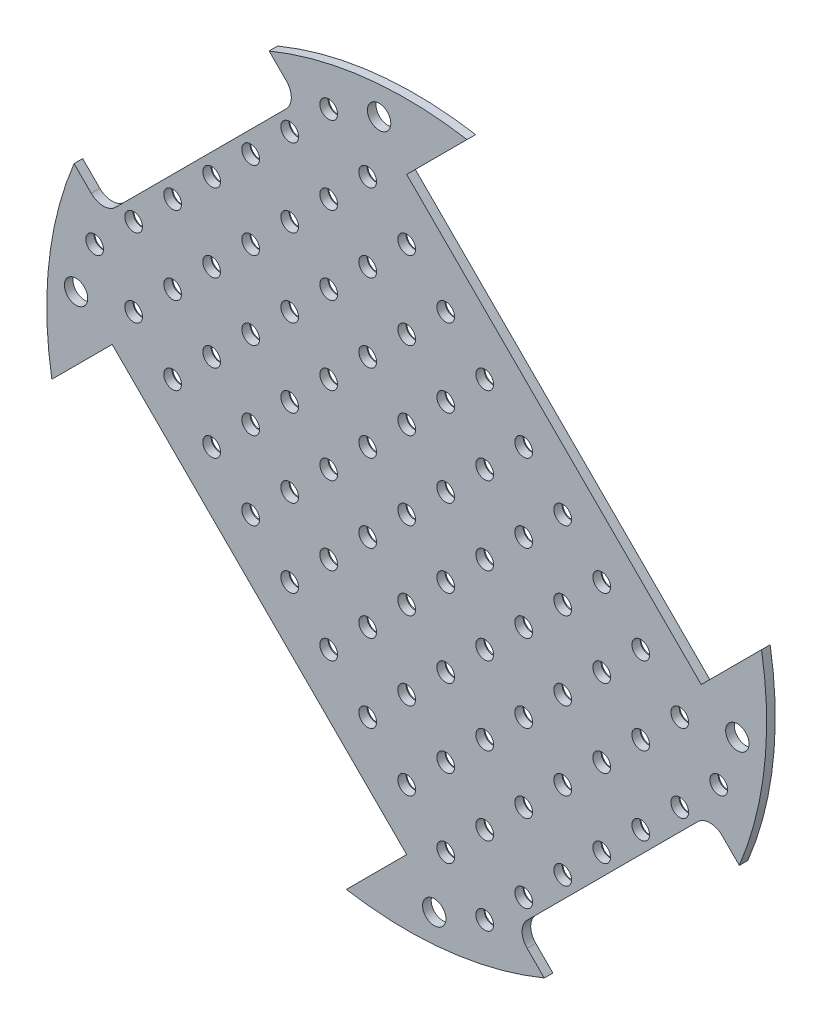
from build123d import *

# Parameters (mm, degrees)
SKETCH1_R             = 66.294
EXTRUDE1_DEPTH        = 1.5875
EXTRUDE2_DEPTH        = 94.767313219
CIRPATTERN1_COUNT     = 2
CIRPATTERN1_ANGLE     = 180
EXTRUDE3_DEPTH        = 94.767313219
CIRPATTERN4_COUNT     = 2
CIRPATTERN4_ANGLE     = 180
F_6_CLEARANCE_HOLE1_D = 4.3053
CIRPATTERN3_COUNT     = 2
CIRPATTERN3_ANGLE     = 180
LPATTERN1_COUNT       = 4
LPATTERN1_PITCH       = 10.16
LPATTERN1_COL_COUNT   = 4
LPATTERN1_COL_PITCH   = 10.16
LPATTERN2_COUNT       = 6
LPATTERN2_PITCH       = 10.16
LPATTERN2_COL_COUNT   = 6
LPATTERN2_COL_PITCH   = 10.16
FILLET1_R             = 3.175


with BuildPart() as part:
    # Sketch1 → Extrude1 (new body)
    with BuildSketch(Plane.XY):
        Circle(SKETCH1_R)
    extrude(amount=EXTRUDE1_DEPTH)

    # Sketch3 → Extrude2 (cut, through all)
    with BuildSketch(Plane.XY.offset(1.5875)):
        Polygon((0, 54.240746971), (54.240746971, 0), (66.421, 12.180253029), (66.421, 66.421), (12.180253029, 66.421), align=None)
    extrude2 = extrude(amount=-EXTRUDE2_DEPTH, mode=Mode.SUBTRACT)

    # CirPattern1: Extrude2 ×2 about axis
    cirpattern1_axis = Axis((0, 0, 0), (0, 0, 1))
    for i in range(1, CIRPATTERN1_COUNT):
        add(extrude2.rotate(cirpattern1_axis, i * CIRPATTERN1_ANGLE / (CIRPATTERN1_COUNT - 1)), mode=Mode.SUBTRACT)

    # Sketch11 → Extrude3 (cut, through all)
    with BuildSketch(Plane(origin=(0, 0, 0), x_dir=(-1, 0, 0), z_dir=(0, 0, -1))):
        Polygon((-55.860393937, -19.939369453), (-69.011215099, -33.090190614), (-33.090190614, -69.011215099), (-19.939369453, -55.860393937), align=None)
    extrude3 = extrude(amount=-EXTRUDE3_DEPTH, mode=Mode.SUBTRACT)

    # CirPattern4: Extrude3 ×2 about axis
    cirpattern4_axis = Axis((0, 0, 0), (0, 0, 1))
    for i in range(1, CIRPATTERN4_COUNT):
        add(extrude3.rotate(cirpattern4_axis, i * CIRPATTERN4_ANGLE / (CIRPATTERN4_COUNT - 1)), mode=Mode.SUBTRACT)

    # #6 Clearance Hole1 (through all)
    with Locations(Plane(origin=(-5.08, 60.8965, 1.5875), x_dir=(1, 0, 0), z_dir=(0, 0, 1))):
        with Locations((0, 0), (65.9765, -65.9765)):
            f_6_clearance_hole1 = Hole(F_6_CLEARANCE_HOLE1_D / 2)

    # CirPattern3: #6 Clearance Hole1 ×2 about axis
    cirpattern3_axis = Axis((0, 0, 0), (0, 0, 1))
    for i in range(1, CIRPATTERN3_COUNT):
        add(f_6_clearance_hole1.rotate(cirpattern3_axis, i * CIRPATTERN3_ANGLE / (CIRPATTERN3_COUNT - 1)), mode=Mode.SUBTRACT)

    # Sketch33 → #4 Clearance Hole4 (revolve, cut)
    with BuildSketch(Plane(origin=(0, 0, 1.5875), x_dir=(0, -1, 0), z_dir=(1, 0, 0))):
        Polygon((0, 0), (0, 2.504574487), (1.63195, 1.524), (1.63195, 0), align=None)
    f_4_clearance_hole4 = revolve(axis=Axis((0, 0, 7.9375), (0, 0, -1)), mode=Mode.SUBTRACT)

    # LPattern1: #4 Clearance Hole4 ×4
    with Locations(*[Vector(-0.7071067811865526, -0.7071067811865426, 0) * (i * LPATTERN1_PITCH) for i in range(1, LPATTERN1_COUNT)]):
        add(f_4_clearance_hole4, mode=Mode.SUBTRACT)

    # LPattern1 col: #4 Clearance Hole4 ×4
    with Locations(*[Vector(0.7071067811865476, 0.7071067811865475, 0) * (i * LPATTERN1_COL_PITCH) for i in range(1, LPATTERN1_COL_COUNT)]):
        add(f_4_clearance_hole4, mode=Mode.SUBTRACT)

    # LPattern2: #4 Clearance Hole4 ×6
    with Locations(*[Vector(0.7071067811865476, -0.7071067811865476, 0) * (i * LPATTERN2_PITCH) for i in range(1, LPATTERN2_COUNT)]):
        add(f_4_clearance_hole4, mode=Mode.SUBTRACT)

    # LPattern2 copy 1 sketch → LPattern2 copy 1 (revolve, cut)
    with BuildSketch(Plane(origin=(0, -14.368409794, 1.5875), x_dir=(0, -1, 0), z_dir=(1, 0, 0))):
        Polygon((0, 0), (0, 2.504574487), (1.63195, 1.524), (1.63195, 0), align=None)
    revolve(axis=Axis((0, -14.368409794, 7.9375), (0, 0, -1)), mode=Mode.SUBTRACT)

    # LPattern2 copy 2 sketch → LPattern2 copy 2 (revolve, cut)
    with BuildSketch(Plane(origin=(7.184204897, -21.552614691, 1.5875), x_dir=(0, -1, 0), z_dir=(1, 0, 0))):
        Polygon((0, 0), (0, 2.504574487), (1.63195, 1.524), (1.63195, 0), align=None)
    revolve(axis=Axis((7.184204897, -21.552614691, 7.9375), (0, 0, -1)), mode=Mode.SUBTRACT)

    # LPattern2 copy 3 sketch → LPattern2 copy 3 (revolve, cut)
    with BuildSketch(Plane(origin=(14.368409794, -28.736819587, 1.5875), x_dir=(0, -1, 0), z_dir=(1, 0, 0))):
        Polygon((0, 0), (0, 2.504574487), (1.63195, 1.524), (1.63195, 0), align=None)
    revolve(axis=Axis((14.368409794, -28.736819587, 7.9375), (0, 0, -1)), mode=Mode.SUBTRACT)

    # LPattern2 copy 4 sketch → LPattern2 copy 4 (revolve, cut)
    with BuildSketch(Plane(origin=(21.552614691, -35.921024484, 1.5875), x_dir=(0, -1, 0), z_dir=(1, 0, 0))):
        Polygon((0, 0), (0, 2.504574487), (1.63195, 1.524), (1.63195, 0), align=None)
    revolve(axis=Axis((21.552614691, -35.921024484, 7.9375), (0, 0, -1)), mode=Mode.SUBTRACT)

    # LPattern2 copy 5 sketch → LPattern2 copy 5 (revolve, cut)
    with BuildSketch(Plane(origin=(28.736819587, -43.105229381, 1.5875), x_dir=(0, -1, 0), z_dir=(1, 0, 0))):
        Polygon((0, 0), (0, 2.504574487), (1.63195, 1.524), (1.63195, 0), align=None)
    revolve(axis=Axis((28.736819587, -43.105229381, 7.9375), (0, 0, -1)), mode=Mode.SUBTRACT)

    # LPattern2 copy 6 sketch → LPattern2 copy 6 (revolve, cut)
    with BuildSketch(Plane(origin=(-7.184204897, -21.552614691, 1.5875), x_dir=(0, -1, 0), z_dir=(1, 0, 0))):
        Polygon((0, 0), (0, 2.504574487), (1.63195, 1.524), (1.63195, 0), align=None)
    revolve(axis=Axis((-7.184204897, -21.552614691, 7.9375), (0, 0, -1)), mode=Mode.SUBTRACT)

    # LPattern2 copy 7 sketch → LPattern2 copy 7 (revolve, cut)
    with BuildSketch(Plane(origin=(0, -28.736819587, 1.5875), x_dir=(0, -1, 0), z_dir=(1, 0, 0))):
        Polygon((0, 0), (0, 2.504574487), (1.63195, 1.524), (1.63195, 0), align=None)
    revolve(axis=Axis((0, -28.736819587, 7.9375), (0, 0, -1)), mode=Mode.SUBTRACT)

    # LPattern2 copy 8 sketch → LPattern2 copy 8 (revolve, cut)
    with BuildSketch(Plane(origin=(7.184204897, -35.921024484, 1.5875), x_dir=(0, -1, 0), z_dir=(1, 0, 0))):
        Polygon((0, 0), (0, 2.504574487), (1.63195, 1.524), (1.63195, 0), align=None)
    revolve(axis=Axis((7.184204897, -35.921024484, 7.9375), (0, 0, -1)), mode=Mode.SUBTRACT)

    # LPattern2 copy 9 sketch → LPattern2 copy 9 (revolve, cut)
    with BuildSketch(Plane(origin=(14.368409794, -43.105229381, 1.5875), x_dir=(0, -1, 0), z_dir=(1, 0, 0))):
        Polygon((0, 0), (0, 2.504574487), (1.63195, 1.524), (1.63195, 0), align=None)
    revolve(axis=Axis((14.368409794, -43.105229381, 7.9375), (0, 0, -1)), mode=Mode.SUBTRACT)

    # LPattern2 copy 10 sketch → LPattern2 copy 10 (revolve, cut)
    with BuildSketch(Plane(origin=(21.552614691, -50.289434278, 1.5875), x_dir=(0, -1, 0), z_dir=(1, 0, 0))):
        Polygon((0, 0), (0, 2.504574487), (1.63195, 1.524), (1.63195, 0), align=None)
    revolve(axis=Axis((21.552614691, -50.289434278, 7.9375), (0, 0, -1)), mode=Mode.SUBTRACT)

    # LPattern2 copy 11 sketch → LPattern2 copy 11 (revolve, cut)
    with BuildSketch(Plane(origin=(-14.368409794, -28.736819587, 1.5875), x_dir=(0, -1, 0), z_dir=(1, 0, 0))):
        Polygon((0, 0), (0, 2.504574487), (1.63195, 1.524), (1.63195, 0), align=None)
    revolve(axis=Axis((-14.368409794, -28.736819587, 7.9375), (0, 0, -1)), mode=Mode.SUBTRACT)

    # LPattern2 copy 12 sketch → LPattern2 copy 12 (revolve, cut)
    with BuildSketch(Plane(origin=(-7.184204897, -35.921024484, 1.5875), x_dir=(0, -1, 0), z_dir=(1, 0, 0))):
        Polygon((0, 0), (0, 2.504574487), (1.63195, 1.524), (1.63195, 0), align=None)
    revolve(axis=Axis((-7.184204897, -35.921024484, 7.9375), (0, 0, -1)), mode=Mode.SUBTRACT)

    # LPattern2 copy 13 sketch → LPattern2 copy 13 (revolve, cut)
    with BuildSketch(Plane(origin=(0, -43.105229381, 1.5875), x_dir=(0, -1, 0), z_dir=(1, 0, 0))):
        Polygon((0, 0), (0, 2.504574487), (1.63195, 1.524), (1.63195, 0), align=None)
    revolve(axis=Axis((0, -43.105229381, 7.9375), (0, 0, -1)), mode=Mode.SUBTRACT)

    # LPattern2 copy 14 sketch → LPattern2 copy 14 (revolve, cut)
    with BuildSketch(Plane(origin=(7.184204897, -50.289434278, 1.5875), x_dir=(0, -1, 0), z_dir=(1, 0, 0))):
        Polygon((0, 0), (0, 2.504574487), (1.63195, 1.524), (1.63195, 0), align=None)
    revolve(axis=Axis((7.184204897, -50.289434278, 7.9375), (0, 0, -1)), mode=Mode.SUBTRACT)

    # LPattern2 copy 15 sketch → LPattern2 copy 15 (revolve, cut)
    with BuildSketch(Plane(origin=(14.368409794, -57.473639175, 1.5875), x_dir=(0, -1, 0), z_dir=(1, 0, 0))):
        Polygon((0, 0), (0, 2.504574487), (1.63195, 1.524), (1.63195, 0), align=None)
    revolve(axis=Axis((14.368409794, -57.473639175, 7.9375), (0, 0, -1)), mode=Mode.SUBTRACT)

    # LPattern2 copy 16 sketch → LPattern2 copy 16 (revolve, cut)
    with BuildSketch(Plane(origin=(14.368409794, 0, 1.5875), x_dir=(0, -1, 0), z_dir=(1, 0, 0))):
        Polygon((0, 0), (0, 2.504574487), (1.63195, 1.524), (1.63195, 0), align=None)
    revolve(axis=Axis((14.368409794, 0, 7.9375), (0, 0, -1)), mode=Mode.SUBTRACT)

    # LPattern2 copy 17 sketch → LPattern2 copy 17 (revolve, cut)
    with BuildSketch(Plane(origin=(21.552614691, -7.184204897, 1.5875), x_dir=(0, -1, 0), z_dir=(1, 0, 0))):
        Polygon((0, 0), (0, 2.504574487), (1.63195, 1.524), (1.63195, 0), align=None)
    revolve(axis=Axis((21.552614691, -7.184204897, 7.9375), (0, 0, -1)), mode=Mode.SUBTRACT)

    # LPattern2 copy 18 sketch → LPattern2 copy 18 (revolve, cut)
    with BuildSketch(Plane(origin=(28.736819587, -14.368409794, 1.5875), x_dir=(0, -1, 0), z_dir=(1, 0, 0))):
        Polygon((0, 0), (0, 2.504574487), (1.63195, 1.524), (1.63195, 0), align=None)
    revolve(axis=Axis((28.736819587, -14.368409794, 7.9375), (0, 0, -1)), mode=Mode.SUBTRACT)

    # LPattern2 copy 19 sketch → LPattern2 copy 19 (revolve, cut)
    with BuildSketch(Plane(origin=(35.921024484, -21.552614691, 1.5875), x_dir=(0, -1, 0), z_dir=(1, 0, 0))):
        Polygon((0, 0), (0, 2.504574487), (1.63195, 1.524), (1.63195, 0), align=None)
    revolve(axis=Axis((35.921024484, -21.552614691, 7.9375), (0, 0, -1)), mode=Mode.SUBTRACT)

    # LPattern2 copy 20 sketch → LPattern2 copy 20 (revolve, cut)
    with BuildSketch(Plane(origin=(43.105229381, -28.736819587, 1.5875), x_dir=(0, -1, 0), z_dir=(1, 0, 0))):
        Polygon((0, 0), (0, 2.504574487), (1.63195, 1.524), (1.63195, 0), align=None)
    revolve(axis=Axis((43.105229381, -28.736819587, 7.9375), (0, 0, -1)), mode=Mode.SUBTRACT)

    # LPattern2 copy 21 sketch → LPattern2 copy 21 (revolve, cut)
    with BuildSketch(Plane(origin=(21.552614691, 7.184204897, 1.5875), x_dir=(0, -1, 0), z_dir=(1, 0, 0))):
        Polygon((0, 0), (0, 2.504574487), (1.63195, 1.524), (1.63195, 0), align=None)
    revolve(axis=Axis((21.552614691, 7.184204897, 7.9375), (0, 0, -1)), mode=Mode.SUBTRACT)

    # LPattern2 copy 22 sketch → LPattern2 copy 22 (revolve, cut)
    with BuildSketch(Plane(origin=(28.736819587, 0, 1.5875), x_dir=(0, -1, 0), z_dir=(1, 0, 0))):
        Polygon((0, 0), (0, 2.504574487), (1.63195, 1.524), (1.63195, 0), align=None)
    revolve(axis=Axis((28.736819587, 0, 7.9375), (0, 0, -1)), mode=Mode.SUBTRACT)

    # LPattern2 copy 23 sketch → LPattern2 copy 23 (revolve, cut)
    with BuildSketch(Plane(origin=(35.921024484, -7.184204897, 1.5875), x_dir=(0, -1, 0), z_dir=(1, 0, 0))):
        Polygon((0, 0), (0, 2.504574487), (1.63195, 1.524), (1.63195, 0), align=None)
    revolve(axis=Axis((35.921024484, -7.184204897, 7.9375), (0, 0, -1)), mode=Mode.SUBTRACT)

    # LPattern2 copy 24 sketch → LPattern2 copy 24 (revolve, cut)
    with BuildSketch(Plane(origin=(43.105229381, -14.368409794, 1.5875), x_dir=(0, -1, 0), z_dir=(1, 0, 0))):
        Polygon((0, 0), (0, 2.504574487), (1.63195, 1.524), (1.63195, 0), align=None)
    revolve(axis=Axis((43.105229381, -14.368409794, 7.9375), (0, 0, -1)), mode=Mode.SUBTRACT)

    # LPattern2 copy 25 sketch → LPattern2 copy 25 (revolve, cut)
    with BuildSketch(Plane(origin=(50.289434278, -21.552614691, 1.5875), x_dir=(0, -1, 0), z_dir=(1, 0, 0))):
        Polygon((0, 0), (0, 2.504574487), (1.63195, 1.524), (1.63195, 0), align=None)
    revolve(axis=Axis((50.289434278, -21.552614691, 7.9375), (0, 0, -1)), mode=Mode.SUBTRACT)

    # LPattern2 copy 26 sketch → LPattern2 copy 26 (revolve, cut)
    with BuildSketch(Plane(origin=(28.736819587, 14.368409794, 1.5875), x_dir=(0, -1, 0), z_dir=(1, 0, 0))):
        Polygon((0, 0), (0, 2.504574487), (1.63195, 1.524), (1.63195, 0), align=None)
    revolve(axis=Axis((28.736819587, 14.368409794, 7.9375), (0, 0, -1)), mode=Mode.SUBTRACT)

    # LPattern2 copy 27 sketch → LPattern2 copy 27 (revolve, cut)
    with BuildSketch(Plane(origin=(35.921024484, 7.184204897, 1.5875), x_dir=(0, -1, 0), z_dir=(1, 0, 0))):
        Polygon((0, 0), (0, 2.504574487), (1.63195, 1.524), (1.63195, 0), align=None)
    revolve(axis=Axis((35.921024484, 7.184204897, 7.9375), (0, 0, -1)), mode=Mode.SUBTRACT)

    # LPattern2 copy 28 sketch → LPattern2 copy 28 (revolve, cut)
    with BuildSketch(Plane(origin=(43.105229381, 0, 1.5875), x_dir=(0, -1, 0), z_dir=(1, 0, 0))):
        Polygon((0, 0), (0, 2.504574487), (1.63195, 1.524), (1.63195, 0), align=None)
    revolve(axis=Axis((43.105229381, 0, 7.9375), (0, 0, -1)), mode=Mode.SUBTRACT)

    # LPattern2 copy 29 sketch → LPattern2 copy 29 (revolve, cut)
    with BuildSketch(Plane(origin=(50.289434278, -7.184204897, 1.5875), x_dir=(0, -1, 0), z_dir=(1, 0, 0))):
        Polygon((0, 0), (0, 2.504574487), (1.63195, 1.524), (1.63195, 0), align=None)
    revolve(axis=Axis((50.289434278, -7.184204897, 7.9375), (0, 0, -1)), mode=Mode.SUBTRACT)

    # LPattern2 copy 30 sketch → LPattern2 copy 30 (revolve, cut)
    with BuildSketch(Plane(origin=(57.473639175, -14.368409794, 1.5875), x_dir=(0, -1, 0), z_dir=(1, 0, 0))):
        Polygon((0, 0), (0, 2.504574487), (1.63195, 1.524), (1.63195, 0), align=None)
    revolve(axis=Axis((57.473639175, -14.368409794, 7.9375), (0, 0, -1)), mode=Mode.SUBTRACT)

    # LPattern2 col: #4 Clearance Hole4 ×6
    with Locations(*[Vector(-0.7071067811865526, 0.7071067811865426, 0) * (i * LPATTERN2_COL_PITCH) for i in range(1, LPATTERN2_COL_COUNT)]):
        add(f_4_clearance_hole4, mode=Mode.SUBTRACT)

    # LPattern2 col copy 1 sketch → LPattern2 col copy 1 (revolve, cut)
    with BuildSketch(Plane(origin=(-14.368409794, 0, 1.5875), x_dir=(0, -1, 0), z_dir=(1, 0, 0))):
        Polygon((0, 0), (0, 2.504574487), (1.63195, 1.524), (1.63195, 0), align=None)
    revolve(axis=Axis((-14.368409794, 0, 7.9375), (0, 0, -1)), mode=Mode.SUBTRACT)

    # LPattern2 col copy 2 sketch → LPattern2 col copy 2 (revolve, cut)
    with BuildSketch(Plane(origin=(-21.552614691, 7.184204897, 1.5875), x_dir=(0, -1, 0), z_dir=(1, 0, 0))):
        Polygon((0, 0), (0, 2.504574487), (1.63195, 1.524), (1.63195, 0), align=None)
    revolve(axis=Axis((-21.552614691, 7.184204897, 7.9375), (0, 0, -1)), mode=Mode.SUBTRACT)

    # LPattern2 col copy 3 sketch → LPattern2 col copy 3 (revolve, cut)
    with BuildSketch(Plane(origin=(-28.736819587, 14.368409794, 1.5875), x_dir=(0, -1, 0), z_dir=(1, 0, 0))):
        Polygon((0, 0), (0, 2.504574487), (1.63195, 1.524), (1.63195, 0), align=None)
    revolve(axis=Axis((-28.736819587, 14.368409794, 7.9375), (0, 0, -1)), mode=Mode.SUBTRACT)

    # LPattern2 col copy 4 sketch → LPattern2 col copy 4 (revolve, cut)
    with BuildSketch(Plane(origin=(-35.921024484, 21.552614691, 1.5875), x_dir=(0, -1, 0), z_dir=(1, 0, 0))):
        Polygon((0, 0), (0, 2.504574487), (1.63195, 1.524), (1.63195, 0), align=None)
    revolve(axis=Axis((-35.921024484, 21.552614691, 7.9375), (0, 0, -1)), mode=Mode.SUBTRACT)

    # LPattern2 col copy 5 sketch → LPattern2 col copy 5 (revolve, cut)
    with BuildSketch(Plane(origin=(-43.105229381, 28.736819587, 1.5875), x_dir=(0, -1, 0), z_dir=(1, 0, 0))):
        Polygon((0, 0), (0, 2.504574487), (1.63195, 1.524), (1.63195, 0), align=None)
    revolve(axis=Axis((-43.105229381, 28.736819587, 7.9375), (0, 0, -1)), mode=Mode.SUBTRACT)

    # LPattern2 col copy 6 sketch → LPattern2 col copy 6 (revolve, cut)
    with BuildSketch(Plane(origin=(-21.552614691, -7.184204897, 1.5875), x_dir=(0, -1, 0), z_dir=(1, 0, 0))):
        Polygon((0, 0), (0, 2.504574487), (1.63195, 1.524), (1.63195, 0), align=None)
    revolve(axis=Axis((-21.552614691, -7.184204897, 7.9375), (0, 0, -1)), mode=Mode.SUBTRACT)

    # LPattern2 col copy 7 sketch → LPattern2 col copy 7 (revolve, cut)
    with BuildSketch(Plane(origin=(-28.736819587, 0, 1.5875), x_dir=(0, -1, 0), z_dir=(1, 0, 0))):
        Polygon((0, 0), (0, 2.504574487), (1.63195, 1.524), (1.63195, 0), align=None)
    revolve(axis=Axis((-28.736819587, 0, 7.9375), (0, 0, -1)), mode=Mode.SUBTRACT)

    # LPattern2 col copy 8 sketch → LPattern2 col copy 8 (revolve, cut)
    with BuildSketch(Plane(origin=(-35.921024484, 7.184204897, 1.5875), x_dir=(0, -1, 0), z_dir=(1, 0, 0))):
        Polygon((0, 0), (0, 2.504574487), (1.63195, 1.524), (1.63195, 0), align=None)
    revolve(axis=Axis((-35.921024484, 7.184204897, 7.9375), (0, 0, -1)), mode=Mode.SUBTRACT)

    # LPattern2 col copy 9 sketch → LPattern2 col copy 9 (revolve, cut)
    with BuildSketch(Plane(origin=(-43.105229381, 14.368409794, 1.5875), x_dir=(0, -1, 0), z_dir=(1, 0, 0))):
        Polygon((0, 0), (0, 2.504574487), (1.63195, 1.524), (1.63195, 0), align=None)
    revolve(axis=Axis((-43.105229381, 14.368409794, 7.9375), (0, 0, -1)), mode=Mode.SUBTRACT)

    # LPattern2 col copy 10 sketch → LPattern2 col copy 10 (revolve, cut)
    with BuildSketch(Plane(origin=(-50.289434278, 21.552614691, 1.5875), x_dir=(0, -1, 0), z_dir=(1, 0, 0))):
        Polygon((0, 0), (0, 2.504574487), (1.63195, 1.524), (1.63195, 0), align=None)
    revolve(axis=Axis((-50.289434278, 21.552614691, 7.9375), (0, 0, -1)), mode=Mode.SUBTRACT)

    # LPattern2 col copy 11 sketch → LPattern2 col copy 11 (revolve, cut)
    with BuildSketch(Plane(origin=(-28.736819587, -14.368409794, 1.5875), x_dir=(0, -1, 0), z_dir=(1, 0, 0))):
        Polygon((0, 0), (0, 2.504574487), (1.63195, 1.524), (1.63195, 0), align=None)
    revolve(axis=Axis((-28.736819587, -14.368409794, 7.9375), (0, 0, -1)), mode=Mode.SUBTRACT)

    # LPattern2 col copy 12 sketch → LPattern2 col copy 12 (revolve, cut)
    with BuildSketch(Plane(origin=(-35.921024484, -7.184204897, 1.5875), x_dir=(0, -1, 0), z_dir=(1, 0, 0))):
        Polygon((0, 0), (0, 2.504574487), (1.63195, 1.524), (1.63195, 0), align=None)
    revolve(axis=Axis((-35.921024484, -7.184204897, 7.9375), (0, 0, -1)), mode=Mode.SUBTRACT)

    # LPattern2 col copy 13 sketch → LPattern2 col copy 13 (revolve, cut)
    with BuildSketch(Plane(origin=(-43.105229381, 0, 1.5875), x_dir=(0, -1, 0), z_dir=(1, 0, 0))):
        Polygon((0, 0), (0, 2.504574487), (1.63195, 1.524), (1.63195, 0), align=None)
    revolve(axis=Axis((-43.105229381, 0, 7.9375), (0, 0, -1)), mode=Mode.SUBTRACT)

    # LPattern2 col copy 14 sketch → LPattern2 col copy 14 (revolve, cut)
    with BuildSketch(Plane(origin=(-50.289434278, 7.184204897, 1.5875), x_dir=(0, -1, 0), z_dir=(1, 0, 0))):
        Polygon((0, 0), (0, 2.504574487), (1.63195, 1.524), (1.63195, 0), align=None)
    revolve(axis=Axis((-50.289434278, 7.184204897, 7.9375), (0, 0, -1)), mode=Mode.SUBTRACT)

    # LPattern2 col copy 15 sketch → LPattern2 col copy 15 (revolve, cut)
    with BuildSketch(Plane(origin=(-57.473639175, 14.368409794, 1.5875), x_dir=(0, -1, 0), z_dir=(1, 0, 0))):
        Polygon((0, 0), (0, 2.504574487), (1.63195, 1.524), (1.63195, 0), align=None)
    revolve(axis=Axis((-57.473639175, 14.368409794, 7.9375), (0, 0, -1)), mode=Mode.SUBTRACT)

    # LPattern2 col copy 16 sketch → LPattern2 col copy 16 (revolve, cut)
    with BuildSketch(Plane(origin=(0, 14.368409794, 1.5875), x_dir=(0, -1, 0), z_dir=(1, 0, 0))):
        Polygon((0, 0), (0, 2.504574487), (1.63195, 1.524), (1.63195, 0), align=None)
    revolve(axis=Axis((0, 14.368409794, 7.9375), (0, 0, -1)), mode=Mode.SUBTRACT)

    # LPattern2 col copy 17 sketch → LPattern2 col copy 17 (revolve, cut)
    with BuildSketch(Plane(origin=(-7.184204897, 21.552614691, 1.5875), x_dir=(0, -1, 0), z_dir=(1, 0, 0))):
        Polygon((0, 0), (0, 2.504574487), (1.63195, 1.524), (1.63195, 0), align=None)
    revolve(axis=Axis((-7.184204897, 21.552614691, 7.9375), (0, 0, -1)), mode=Mode.SUBTRACT)

    # LPattern2 col copy 18 sketch → LPattern2 col copy 18 (revolve, cut)
    with BuildSketch(Plane(origin=(-14.368409794, 28.736819587, 1.5875), x_dir=(0, -1, 0), z_dir=(1, 0, 0))):
        Polygon((0, 0), (0, 2.504574487), (1.63195, 1.524), (1.63195, 0), align=None)
    revolve(axis=Axis((-14.368409794, 28.736819587, 7.9375), (0, 0, -1)), mode=Mode.SUBTRACT)

    # LPattern2 col copy 19 sketch → LPattern2 col copy 19 (revolve, cut)
    with BuildSketch(Plane(origin=(-21.552614691, 35.921024484, 1.5875), x_dir=(0, -1, 0), z_dir=(1, 0, 0))):
        Polygon((0, 0), (0, 2.504574487), (1.63195, 1.524), (1.63195, 0), align=None)
    revolve(axis=Axis((-21.552614691, 35.921024484, 7.9375), (0, 0, -1)), mode=Mode.SUBTRACT)

    # LPattern2 col copy 20 sketch → LPattern2 col copy 20 (revolve, cut)
    with BuildSketch(Plane(origin=(-28.736819587, 43.105229381, 1.5875), x_dir=(0, -1, 0), z_dir=(1, 0, 0))):
        Polygon((0, 0), (0, 2.504574487), (1.63195, 1.524), (1.63195, 0), align=None)
    revolve(axis=Axis((-28.736819587, 43.105229381, 7.9375), (0, 0, -1)), mode=Mode.SUBTRACT)

    # LPattern2 col copy 21 sketch → LPattern2 col copy 21 (revolve, cut)
    with BuildSketch(Plane(origin=(7.184204897, 21.552614691, 1.5875), x_dir=(0, -1, 0), z_dir=(1, 0, 0))):
        Polygon((0, 0), (0, 2.504574487), (1.63195, 1.524), (1.63195, 0), align=None)
    revolve(axis=Axis((7.184204897, 21.552614691, 7.9375), (0, 0, -1)), mode=Mode.SUBTRACT)

    # LPattern2 col copy 22 sketch → LPattern2 col copy 22 (revolve, cut)
    with BuildSketch(Plane(origin=(0, 28.736819587, 1.5875), x_dir=(0, -1, 0), z_dir=(1, 0, 0))):
        Polygon((0, 0), (0, 2.504574487), (1.63195, 1.524), (1.63195, 0), align=None)
    revolve(axis=Axis((0, 28.736819587, 7.9375), (0, 0, -1)), mode=Mode.SUBTRACT)

    # LPattern2 col copy 23 sketch → LPattern2 col copy 23 (revolve, cut)
    with BuildSketch(Plane(origin=(-7.184204897, 35.921024484, 1.5875), x_dir=(0, -1, 0), z_dir=(1, 0, 0))):
        Polygon((0, 0), (0, 2.504574487), (1.63195, 1.524), (1.63195, 0), align=None)
    revolve(axis=Axis((-7.184204897, 35.921024484, 7.9375), (0, 0, -1)), mode=Mode.SUBTRACT)

    # LPattern2 col copy 24 sketch → LPattern2 col copy 24 (revolve, cut)
    with BuildSketch(Plane(origin=(-14.368409794, 43.105229381, 1.5875), x_dir=(0, -1, 0), z_dir=(1, 0, 0))):
        Polygon((0, 0), (0, 2.504574487), (1.63195, 1.524), (1.63195, 0), align=None)
    revolve(axis=Axis((-14.368409794, 43.105229381, 7.9375), (0, 0, -1)), mode=Mode.SUBTRACT)

    # LPattern2 col copy 25 sketch → LPattern2 col copy 25 (revolve, cut)
    with BuildSketch(Plane(origin=(-21.552614691, 50.289434278, 1.5875), x_dir=(0, -1, 0), z_dir=(1, 0, 0))):
        Polygon((0, 0), (0, 2.504574487), (1.63195, 1.524), (1.63195, 0), align=None)
    revolve(axis=Axis((-21.552614691, 50.289434278, 7.9375), (0, 0, -1)), mode=Mode.SUBTRACT)

    # LPattern2 col copy 26 sketch → LPattern2 col copy 26 (revolve, cut)
    with BuildSketch(Plane(origin=(14.368409794, 28.736819587, 1.5875), x_dir=(0, -1, 0), z_dir=(1, 0, 0))):
        Polygon((0, 0), (0, 2.504574487), (1.63195, 1.524), (1.63195, 0), align=None)
    revolve(axis=Axis((14.368409794, 28.736819587, 7.9375), (0, 0, -1)), mode=Mode.SUBTRACT)

    # LPattern2 col copy 27 sketch → LPattern2 col copy 27 (revolve, cut)
    with BuildSketch(Plane(origin=(7.184204897, 35.921024484, 1.5875), x_dir=(0, -1, 0), z_dir=(1, 0, 0))):
        Polygon((0, 0), (0, 2.504574487), (1.63195, 1.524), (1.63195, 0), align=None)
    revolve(axis=Axis((7.184204897, 35.921024484, 7.9375), (0, 0, -1)), mode=Mode.SUBTRACT)

    # LPattern2 col copy 28 sketch → LPattern2 col copy 28 (revolve, cut)
    with BuildSketch(Plane(origin=(0, 43.105229381, 1.5875), x_dir=(0, -1, 0), z_dir=(1, 0, 0))):
        Polygon((0, 0), (0, 2.504574487), (1.63195, 1.524), (1.63195, 0), align=None)
    revolve(axis=Axis((0, 43.105229381, 7.9375), (0, 0, -1)), mode=Mode.SUBTRACT)

    # LPattern2 col copy 29 sketch → LPattern2 col copy 29 (revolve, cut)
    with BuildSketch(Plane(origin=(-7.184204897, 50.289434278, 1.5875), x_dir=(0, -1, 0), z_dir=(1, 0, 0))):
        Polygon((0, 0), (0, 2.504574487), (1.63195, 1.524), (1.63195, 0), align=None)
    revolve(axis=Axis((-7.184204897, 50.289434278, 7.9375), (0, 0, -1)), mode=Mode.SUBTRACT)

    # LPattern2 col copy 30 sketch → LPattern2 col copy 30 (revolve, cut)
    with BuildSketch(Plane(origin=(-14.368409794, 57.473639175, 1.5875), x_dir=(0, -1, 0), z_dir=(1, 0, 0))):
        Polygon((0, 0), (0, 2.504574487), (1.63195, 1.524), (1.63195, 0), align=None)
    revolve(axis=Axis((-14.368409794, 57.473639175, 7.9375), (0, 0, -1)), mode=Mode.SUBTRACT)

    # Fillet1
    fillet1_edges = [part.edges().sort_by_distance(p)[0] for p in [
        (19.939369453, -55.860393937, 0.79375),
        (55.860393937, -19.939369453, 0.79375),
        (-19.939369453, 55.860393937, 0.79375),
        (-55.860393937, 19.939369453, 0.79375),
    ]]
    fillet(fillet1_edges, radius=FILLET1_R)


solid = part.part
